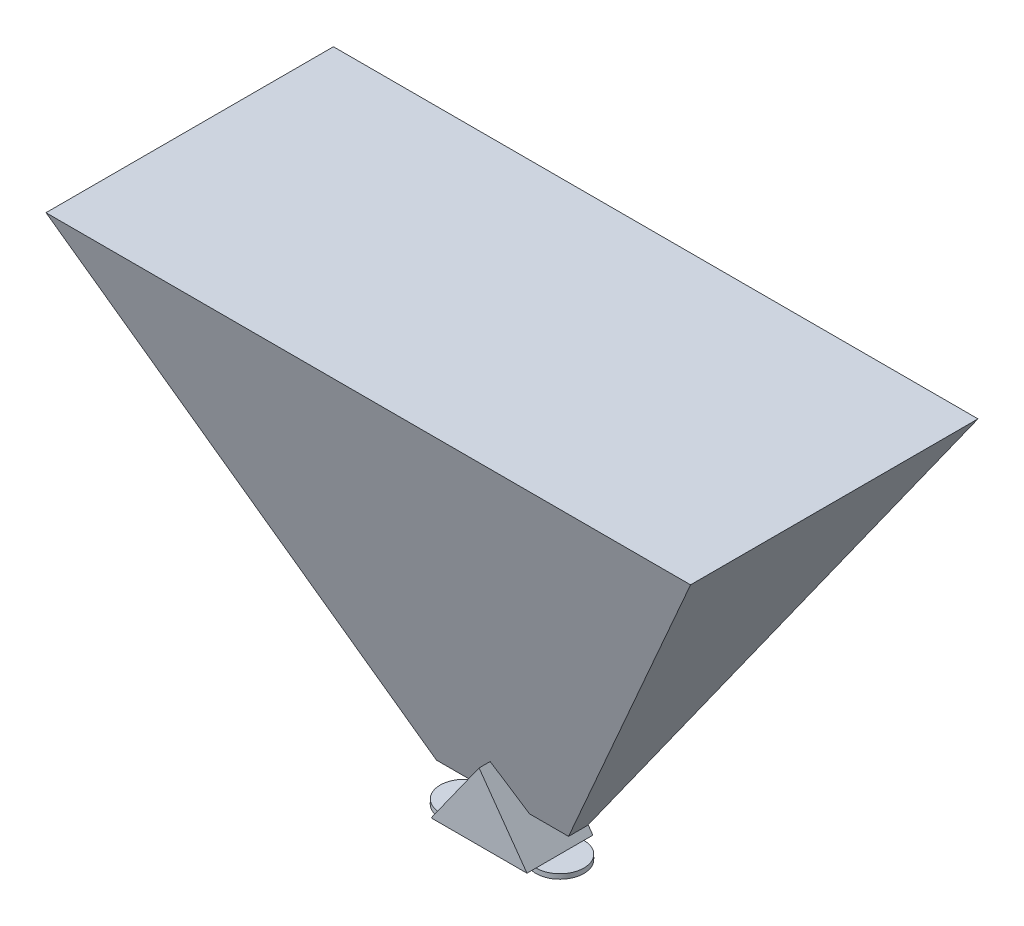
from build123d import *

# Parameters (mm, degrees)
BOSS_EXTRUDE1_DEPTH      = 76.2
BOSS_EXTRUDE6_DEPTH      = 203.2
BOSS_EXTRUDE6_DEPTH_BACK = 152.4
CUT_EXTRUDE1_DEPTH       = 397.760683536
SKETCH9_W                = 152.4
SKETCH9_H                = 70.280514467
CUT_EXTRUDE2_DEPTH       = 475.511158984
SKETCH10_R               = 12.7
BOSS_EXTRUDE7_DEPTH      = 2.54
SKETCH11_W               = 58.732266579
SKETCH11_H               = 35.638828091
CUT_EXTRUDE3_DEPTH       = 316.168697926


with BuildPart() as part:
    # Sketch1 → Boss-Extrude1 (new, symmetric)
    with BuildSketch(Plane.XY):
        Polygon((0, 0), (50.8, 0), (25.4, 35.638828091), align=None)
    extrude(amount=BOSS_EXTRUDE1_DEPTH, both=True)

    # Sketch7 → Boss-Extrude6 (add, two sides: drawn at the far end of the back side and taken through both)
    with BuildSketch(Plane(origin=(0, 0, 0), x_dir=(0, 0, -1), z_dir=(1, 0, 0)).offset(-BOSS_EXTRUDE6_DEPTH_BACK)):
        Polygon((76.2, 234.519485533), (76.2, 304.8), (-76.2, 304.8), (-76.2, 234.519485533), (-5.035820147, 15.498660762), (5.035820147, 15.498660762), align=None)
    extrude(amount=BOSS_EXTRUDE6_DEPTH + BOSS_EXTRUDE6_DEPTH_BACK)

    # Sketch8 → Cut-Extrude1 (cut, through all)
    with BuildSketch(Plane.XY.offset(76.2)):
        Polygon((-145.479084616, 234.519485533), (-152.4, 234.519485533), (-152.4, 15.498660762), (-9.614258599, 15.498660762), align=None)
        Polygon((60.413322139, 15.498660762), (196.264914484, 234.519485533), (203.2, 234.519485533), (203.2, 15.498660762), align=None)
    extrude(amount=-CUT_EXTRUDE1_DEPTH, mode=Mode.SUBTRACT)

    # Sketch9 → Cut-Extrude2 (cut, through all)
    with BuildSketch(Plane(origin=(203.2, 0, 0), x_dir=(0, 0, -1), z_dir=(1, 0, 0))):
        with Locations((0, 269.659742767)):
            Rectangle(SKETCH9_W, SKETCH9_H)
    extrude(amount=-CUT_EXTRUDE2_DEPTH, mode=Mode.SUBTRACT)

    # Sketch10 → Boss-Extrude7 (add)
    with BuildSketch(Plane(origin=(0, 0, 0), x_dir=(-1, 0, 0), z_dir=(0, -1, 0))):
        with Locations(Location((0, 0, 0), (0, 0, 90))):
            Circle(SKETCH10_R)
        with Locations(Location((-50.8, 0, 0), (0, 0, 90))):
            Circle(SKETCH10_R)
    extrude(amount=BOSS_EXTRUDE7_DEPTH)

    # Sketch11 → Cut-Extrude3 (cut, through all)
    with BuildSketch(Plane(origin=(50.8, 0, 0), x_dir=(0, 0, -1), z_dir=(1, 0, 0))):
        with Locations((-46.833866711, 17.819414046)):
            Rectangle(SKETCH11_W, SKETCH11_H)
        with Locations((46.833866711, 17.819414046)):
            Rectangle(SKETCH11_W, SKETCH11_H)
    extrude(amount=-CUT_EXTRUDE3_DEPTH, mode=Mode.SUBTRACT)


solid = part.part
